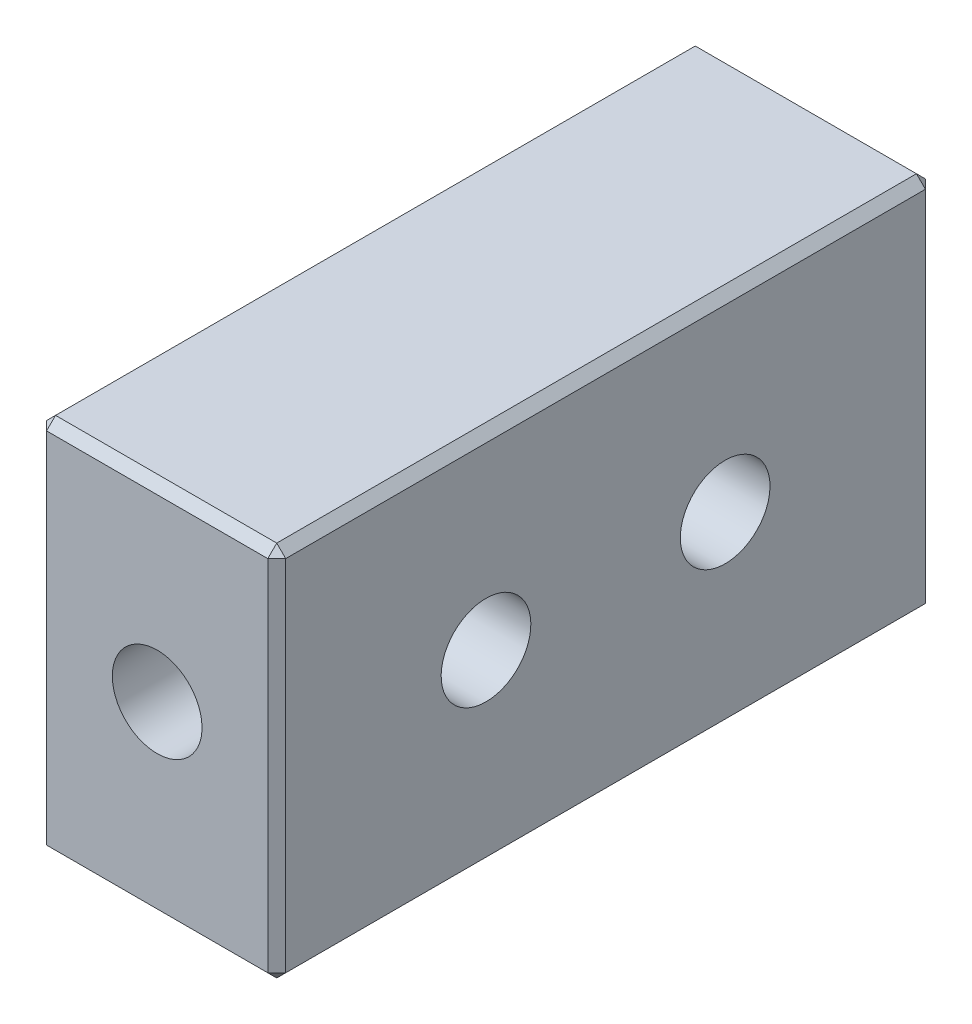
from build123d import *

# Parameters (mm, degrees)
SKETCH_1_W          = 8
SKETCH_1_H          = 12.6
EXTRUDE_1_DEPTH     = 22
CHAMFER_1_SIZE      = 0.3
SKETCH_2_R          = 1.5
CUT_EXTRUDE_1_DEPTH = 25.242318371
SKETCH_3_R          = 1.5
CUT_EXTRUDE_2_DEPTH = 4


with BuildPart() as part:
    # 草图1 → 凸台-拉伸1 (new body)
    with BuildSketch(Plane.XY):
        Rectangle(SKETCH_1_W, SKETCH_1_H)
    extrude(amount=EXTRUDE_1_DEPTH)

    # 倒角1
    chamfer_1_edges = [part.edges().sort_by_distance(p)[0] for p in [
        (-4, 0, 22),
        (0, -6.3, 22),
        (4, 0, 22),
        (0, -6.3, 0),
        (-4, 0, 0),
        (0, 6.3, 0),
        (4, 0, 0),
        (4, -6.3, 11),
        (-4, -6.3, 11),
        (-4, 6.3, 11),
        (4, 6.3, 11),
        (0, 6.3, 22),
    ]]
    chamfer(chamfer_1_edges, length=CHAMFER_1_SIZE)

    # 草图2 → 切除-拉伸1 (cut, through all)
    with BuildSketch(Plane.ZY.offset(4)):
        with Locations(Location((15, 0, 0), (0, 0, 270))):
            Circle(SKETCH_2_R)
        with Locations(Location((7, 0, 0), (0, 0, 90))):
            Circle(SKETCH_2_R)
    extrude(amount=-CUT_EXTRUDE_1_DEPTH, mode=Mode.SUBTRACT)

    # 草图3 → 切除-拉伸2 (cut)
    with BuildSketch(Plane(origin=(0, 0, 0), x_dir=(-1, 0, 0), z_dir=(0, 0, -1))):
        Circle(SKETCH_3_R)
    cut_extrude_2 = extrude(amount=-CUT_EXTRUDE_2_DEPTH, mode=Mode.SUBTRACT)

    # 镜向1: 切除-拉伸2 across plane
    add(cut_extrude_2.mirror(Plane(origin=(0, 0, 11), x_dir=(1, 0, 0), z_dir=(0, 0, -1))), mode=Mode.SUBTRACT)


solid = part.part
